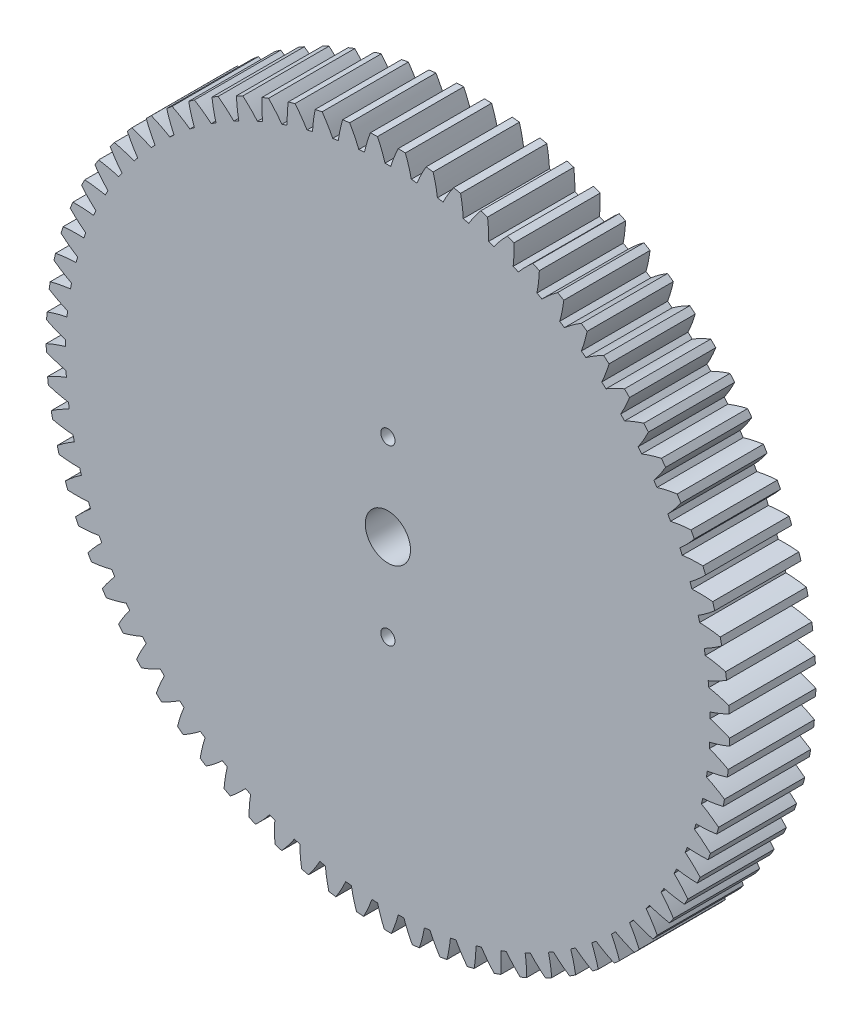
from build123d import *

# Parameters (mm, degrees)
MODEL_R             = 2.625
MODEL_R_2           = 0.825
BOSS_EXTRUDE2_DEPTH = 10


with BuildPart() as part:
    # Model → Boss-Extrude2 (new body)
    with BuildSketch(Plane.XY):
        with BuildLine():
            ThreePointArc((-39.573855354, 2.012609605), (-38.483782884, 1.509137576), (-37.358060536, 1.091416054))
            ThreePointArc((-37.358060536, 1.091416054), (-37.366223524, 0.762374936), (-37.371488451, 0.433274691))
            ThreePointArc((-37.371488451, 0.433274691), (-38.513312242, 0.06181742), (-39.623013466, -0.396773105))
            ThreePointArc((-39.623013466, -0.396773105), (-39.616755155, -0.808292044), (-39.606222982, -1.219723785))
            ThreePointArc((-39.606222982, -1.219723785), (-38.478739993, -1.632669526), (-37.322715212, -1.957244292))
            ThreePointArc((-37.322715212, -1.957244292), (-37.304031133, -2.285855912), (-37.282453816, -2.614290244))
            ThreePointArc((-37.282453816, -2.614290244), (-38.390201066, -3.077580761), (-39.458830466, -3.625096314))
            ThreePointArc((-39.458830466, -3.625096314), (-39.419050364, -4.034735848), (-39.37501773, -4.443940114))
            ThreePointArc((-39.37501773, -4.443940114), (-38.217627437, -4.763611481), (-37.038993376, -4.9928795))
            ThreePointArc((-37.038993376, -4.9928795), (-36.993586569, -5.318874766), (-36.945310601, -5.644457508))
            ThreePointArc((-36.945310601, -5.644457508), (-38.011609436, -6.196498149), (-39.032055459, -6.829295106))
            ThreePointArc((-39.032055459, -6.829295106), (-38.959018298, -7.234329151), (-38.881778232, -7.638582755))
            ThreePointArc((-38.881778232, -7.638582755), (-37.702182875, -7.862852388), (-36.50878315, -7.995287919))
            ThreePointArc((-36.50878315, -7.995287919), (-36.43695579, -8.316497386), (-36.362302441, -8.637061839))
            ThreePointArc((-36.362302441, -8.637061839), (-37.380056817, -9.274178864), (-38.345528563, -9.988046066))
            ThreePointArc((-38.345528563, -9.988046066), (-38.239720392, -10.385779186), (-38.129786915, -10.782391887))
            ThreePointArc((-38.129786915, -10.782391887), (-36.935836507, -10.90976731), (-35.735612996, -10.944489016))
            ThreePointArc((-35.735612996, -10.944489016), (-35.637843082, -11.258775088), (-35.537309157, -11.572187948))
            ThreePointArc((-35.537309157, -11.572187948), (-36.499746087, -12.290141449), (-37.403818501, -13.080328227))
            ThreePointArc((-37.403818501, -13.080328227), (-37.265943457, -13.468113575), (-37.124048157, -13.854445981))
            ThreePointArc((-37.124048157, -13.854445981), (-35.923688241, -13.88407953), (-34.724628233, -13.820856344))
            ThreePointArc((-34.724628233, -13.820856344), (-34.601566408, -14.126127499), (-34.475820943, -14.430303056))
            ThreePointArc((-34.475820943, -14.430303056), (-35.376535569, -15.22431517), (-36.213192198, -16.085562962))
            ThreePointArc((-36.213192198, -16.085562962), (-36.044167816, -16.46081989), (-35.871254983, -16.834301023))
            ThreePointArc((-35.871254983, -16.834301023), (-34.672473757, -16.765995492), (-33.482556799, -16.605248153))
            ThreePointArc((-33.482556799, -16.605248153), (-33.335022018, -16.899472863), (-33.18490183, -17.192386878))
            ThreePointArc((-33.18490183, -17.192386878), (-34.017900043, -18.057173586), (-34.781573076, -18.983750929))
            ThreePointArc((-34.781573076, -18.983750929), (-34.582524185, -19.343982165), (-34.379744526, -19.702126568))
            ThreePointArc((-34.379744526, -19.702126568), (-33.19051968, -19.53633652), (-32.017664473, -19.279134776))
            ThreePointArc((-32.017664473, -19.279134776), (-31.846638557, -19.560355023), (-31.673142669, -19.840058201))
            ThreePointArc((-31.673142669, -19.840058201), (-32.432881005, -20.769864491), (-33.118488324, -21.755605166))
            ThreePointArc((-33.118488324, -21.755605166), (-32.890739561, -22.098413429), (-32.659442541, -22.438837712))
            ThreePointArc((-32.659442541, -22.438837712), (-31.487688171, -22.176666451), (-30.339699873, -21.824721937))
            ThreePointArc((-30.339699873, -21.824721937), (-30.146320971, -22.091066247), (-29.95060397, -22.355697211))
            ThreePointArc((-29.95060397, -22.355697211), (-30.632026495, -23.344335374), (-31.235005496, -24.38267944))
            ThreePointArc((-31.235005496, -24.38267944), (-30.980072493, -24.705783399), (-30.721797355, -25.026222094))
            ThreePointArc((-30.721797355, -25.026222094), (-29.575311292, -24.669414326), (-28.459829575, -24.225069175))
            ThreePointArc((-28.459829575, -24.225069175), (-28.245384592, -24.47476507), (-28.028748944, -24.722562744))
            ThreePointArc((-28.028748944, -24.722562744), (-28.627320902, -25.763453557), (-29.143658859, -26.847491005))
            ThreePointArc((-29.143658859, -26.847491005), (-28.863238153, -27.148740455), (-28.579703676, -27.447061096))
            ThreePointArc((-28.579703676, -27.447061096), (-27.466115596, -26.997991319), (-26.390563808, -26.464202574))
            ThreePointArc((-26.390563808, -26.464202574), (-26.156479839, -26.69558837), (-25.920367217, -26.924903701))
            ThreePointArc((-25.920367217, -26.924903701), (-26.432105212, -28.011120207), (-26.858365982, -29.133636947))
            ThreePointArc((-26.858365982, -29.133636947), (-26.554323725, -29.411027124), (-26.247416784, -29.685244435))
            ThreePointArc((-26.247416784, -29.685244435), (-25.174137433, -29.146901134), (-24.145673192, -28.527221072))
            ThreePointArc((-24.145673192, -28.527221072), (-23.893508028, -28.738756934), (-23.639489723, -28.948063866))
            ThreePointArc((-23.639489723, -28.948063866), (-24.060988223, -30.072377474), (-24.39433511, -31.225903342))
            ThreePointArc((-24.39433511, -31.225903342), (-24.068694654, -31.477588259), (-23.740457664, -31.72587737))
            ThreePointArc((-23.740457664, -31.72587737), (-22.714629538, -31.101843131), (-21.740097106, -30.400395619))
            ThreePointArc((-21.740097106, -30.400395619), (-21.471528863, -30.590673812), (-21.201295325, -30.778579443))
            ThreePointArc((-21.201295325, -30.778579443), (-21.529749327, -31.93350803), (-21.767963963, -33.110366502))
            ThreePointArc((-21.767963963, -33.110366502), (-21.422892392, -33.334671238), (-21.075509715, -33.555379825))
            ThreePointArc((-21.075509715, -33.555379825), (-20.103959532, -32.849807494), (-19.189844259, -32.07126055))
            ThreePointArc((-19.189844259, -32.07126055), (-18.906660217, -32.239014802), (-18.622009805, -32.404268651))
            ThreePointArc((-18.622009805, -32.404268651), (-18.855233502, -33.582126359), (-18.996730607, -34.774485636))
            ThreePointArc((-18.996730607, -34.774485636), (-18.634524314, -34.96991748), (-18.270307727, -35.161576764))
            ThreePointArc((-18.270307727, -35.161576764), (-17.359500991, -34.379161807), (-16.511886166, -33.528696533))
            ThreePointArc((-16.511886166, -33.528696533), (-16.215970866, -33.672810469), (-15.918797882, -33.814312797))
            ThreePointArc((-15.918797882, -33.814312797), (-16.055239208, -35.007261178), (-16.099077143, -36.207186305))
            ThreePointArc((-16.099077143, -36.207186305), (-15.722146553, -36.37244469), (-15.343519855, -36.533779211))
            ThreePointArc((-15.343519855, -36.533779211), (-14.499517836, -35.679728471), (-13.724044194, -34.763004573))
            ThreePointArc((-13.724044194, -34.763004573), (-13.417366904, -34.882519137), (-13.109648986, -34.999328271))
            ThreePointArc((-13.109648986, -34.999328271), (-13.148399947, -36.19942845), (-13.094286977, -37.398934123))
            ThreePointArc((-13.094286977, -37.398934123), (-12.705140499, -37.532919283), (-12.314623389, -37.662855385))
            ThreePointArc((-12.314623389, -37.662855385), (-11.543042782, -36.742852429), (-10.844870973, -35.765970553))
            ThreePointArc((-10.844870973, -35.765970553), (-10.529472579, -35.860090396), (-10.213257538, -35.951428991))
            ThreePointArc((-10.213257538, -35.951428991), (-10.154060253, -37.150694497), (-10.002356492, -38.341798205))
            ThreePointArc((-10.002356492, -38.341798205), (-9.603583832, -38.44361849), (-9.203775137, -38.541291471))
            ThreePointArc((-9.203775137, -38.541291471), (-8.509750682, -37.561458765), (-7.893526924, -36.530919899))
            ThreePointArc((-7.893526924, -36.530919899), (-7.571506352, -36.599018669), (-7.248898547, -36.664278881))
            ThreePointArc((-7.248898547, -36.664278881), (-7.092146963, -37.854728802), (-6.843861974, -39.029503946))
            ThreePointArc((-6.843861974, -39.029503946), (-6.438116899, -39.098481758), (-6.03167728, -39.16324162))
            ThreePointArc((-6.03167728, -39.16324162), (-5.419827596, -38.130099791), (-4.889652756, -37.052762001))
            ThreePointArc((-4.889652756, -37.052762001), (-4.563152999, -37.094386512), (-4.236299331, -37.133134045))
            ThreePointArc((-4.236299331, -37.133134045), (-3.983036606, -38.306846133), (-3.639822684, -39.457474778))
            ThreePointArc((-3.639822684, -39.457474778), (-3.229805361, -39.493151081), (-2.819439605, -39.524566858))
            ThreePointArc((-2.819439605, -39.524566858), (-2.293836451, -38.444991294), (-1.853238756, -37.328024085))
            ThreePointArc((-1.853238756, -37.328024085), (-1.524432615, -37.342897333), (-1.195508243, -37.354874328))
            ThreePointArc((-1.195508243, -37.354874328), (-0.847419797, -38.504037723), (-0.411560974, -39.622862625))
            ThreePointArc((-0.411560974, -39.622862625), (0, -39.625), (0.411560974, -39.622862625))
            ThreePointArc((0.411560974, -39.622862625), (0.847419797, -38.504037723), (1.195508243, -37.354874328))
            ThreePointArc((1.195508243, -37.354874328), (1.524432615, -37.342897333), (1.853238756, -37.328024085))
            ThreePointArc((1.853238756, -37.328024085), (2.293836451, -38.444991294), (2.819439605, -39.524566858))
            ThreePointArc((2.819439605, -39.524566858), (3.229805361, -39.493151081), (3.639822684, -39.457474778))
            ThreePointArc((3.639822684, -39.457474778), (3.983036606, -38.306846133), (4.236299331, -37.133134045))
            ThreePointArc((4.236299331, -37.133134045), (4.563152999, -37.094386512), (4.889652756, -37.052762001))
            ThreePointArc((4.889652756, -37.052762001), (5.419827596, -38.130099791), (6.03167728, -39.16324162))
            ThreePointArc((6.03167728, -39.16324162), (6.438116899, -39.098481758), (6.843861974, -39.029503946))
            ThreePointArc((6.843861974, -39.029503946), (7.092146963, -37.854728802), (7.248898547, -36.664278881))
            ThreePointArc((7.248898547, -36.664278881), (7.571506352, -36.599018669), (7.893526924, -36.530919899))
            ThreePointArc((7.893526924, -36.530919899), (8.509750682, -37.561458765), (9.203775137, -38.541291471))
            ThreePointArc((9.203775137, -38.541291471), (9.603583832, -38.44361849), (10.002356491, -38.341798205))
            ThreePointArc((10.002356491, -38.341798205), (10.154060253, -37.150694497), (10.213257538, -35.951428991))
            ThreePointArc((10.213257538, -35.951428991), (10.529472579, -35.860090396), (10.844870973, -35.765970553))
            ThreePointArc((10.844870973, -35.765970553), (11.543042782, -36.742852429), (12.314623389, -37.662855385))
            ThreePointArc((12.314623389, -37.662855385), (12.705140499, -37.532919283), (13.094286977, -37.398934123))
            ThreePointArc((13.094286977, -37.398934123), (13.148399947, -36.19942845), (13.109648986, -34.999328272))
            ThreePointArc((13.109648986, -34.999328272), (13.417366904, -34.882519137), (13.724044194, -34.763004573))
            ThreePointArc((13.724044194, -34.763004573), (14.499517836, -35.679728471), (15.343519855, -36.533779211))
            ThreePointArc((15.343519855, -36.533779211), (15.722146553, -36.372444691), (16.099077143, -36.207186305))
            ThreePointArc((16.099077143, -36.207186305), (16.055239208, -35.007261178), (15.918797882, -33.814312798))
            ThreePointArc((15.918797882, -33.814312798), (16.215970866, -33.672810469), (16.511886166, -33.528696534))
            ThreePointArc((16.511886166, -33.528696534), (17.359500991, -34.379161808), (18.270307727, -35.161576764))
            ThreePointArc((18.270307727, -35.161576764), (18.634524315, -34.96991748), (18.996730607, -34.774485636))
            ThreePointArc((18.996730607, -34.774485636), (18.855233502, -33.58212636), (18.622009805, -32.404268651))
            ThreePointArc((18.622009805, -32.404268651), (18.906660217, -32.239014803), (19.18984426, -32.07126055))
            ThreePointArc((19.18984426, -32.07126055), (20.103959532, -32.849807494), (21.075509716, -33.555379825))
            ThreePointArc((21.075509716, -33.555379825), (21.422892392, -33.334671238), (21.767963963, -33.110366502))
            ThreePointArc((21.767963963, -33.110366502), (21.529749328, -31.933508031), (21.201295325, -30.778579443))
            ThreePointArc((21.201295325, -30.778579443), (21.471528863, -30.590673812), (21.740097106, -30.40039562))
            ThreePointArc((21.740097106, -30.40039562), (22.714629538, -31.101843132), (23.740457664, -31.72587737))
            ThreePointArc((23.740457664, -31.72587737), (24.068694654, -31.477588259), (24.39433511, -31.225903342))
            ThreePointArc((24.39433511, -31.225903342), (24.060988224, -30.072377474), (23.639489723, -28.948063867))
            ThreePointArc((23.639489723, -28.948063867), (23.893508028, -28.738756934), (24.145673193, -28.527221072))
            ThreePointArc((24.145673193, -28.527221072), (25.174137433, -29.146901135), (26.247416784, -29.685244435))
            ThreePointArc((26.247416784, -29.685244435), (26.554323725, -29.411027124), (26.858365982, -29.133636947))
            ThreePointArc((26.858365982, -29.133636947), (26.432105213, -28.011120208), (25.920367217, -26.924903701))
            ThreePointArc((25.920367217, -26.924903701), (26.156479839, -26.69558837), (26.390563808, -26.464202574))
            ThreePointArc((26.390563808, -26.464202574), (27.466115597, -26.99799132), (28.579703676, -27.447061096))
            ThreePointArc((28.579703676, -27.447061096), (28.863238153, -27.148740456), (29.14365886, -26.847491005))
            ThreePointArc((29.14365886, -26.847491005), (28.627320903, -25.763453557), (28.028748944, -24.722562744))
            ThreePointArc((28.028748944, -24.722562744), (28.245384592, -24.47476507), (28.459829575, -24.225069175))
            ThreePointArc((28.459829575, -24.225069175), (29.575311292, -24.669414327), (30.721797355, -25.026222094))
            ThreePointArc((30.721797355, -25.026222094), (30.980072493, -24.705783399), (31.235005496, -24.38267944))
            ThreePointArc((31.235005496, -24.38267944), (30.632026495, -23.344335374), (29.950603971, -22.355697211))
            ThreePointArc((29.950603971, -22.355697211), (30.146320971, -22.091066247), (30.339699873, -21.824721937))
            ThreePointArc((30.339699873, -21.824721937), (31.487688171, -22.176666451), (32.659442541, -22.438837712))
            ThreePointArc((32.659442541, -22.438837712), (32.890739562, -22.098413429), (33.118488324, -21.755605166))
            ThreePointArc((33.118488324, -21.755605166), (32.432881005, -20.769864491), (31.673142669, -19.840058201))
            ThreePointArc((31.673142669, -19.840058201), (31.846638557, -19.560355023), (32.017664473, -19.279134776))
            ThreePointArc((32.017664473, -19.279134776), (33.19051968, -19.53633652), (34.379744526, -19.702126568))
            ThreePointArc((34.379744526, -19.702126568), (34.582524185, -19.343982165), (34.781573076, -18.983750929))
            ThreePointArc((34.781573076, -18.983750929), (34.017900043, -18.057173586), (33.18490183, -17.192386878))
            ThreePointArc((33.18490183, -17.192386878), (33.335022018, -16.899472863), (33.482556799, -16.605248153))
            ThreePointArc((33.482556799, -16.605248153), (34.672473757, -16.765995492), (35.871254983, -16.834301023))
            ThreePointArc((35.871254983, -16.834301023), (36.044167816, -16.46081989), (36.213192198, -16.085562962))
            ThreePointArc((36.213192198, -16.085562962), (35.376535569, -15.22431517), (34.475820943, -14.430303056))
            ThreePointArc((34.475820943, -14.430303056), (34.601566408, -14.126127499), (34.724628233, -13.820856344))
            ThreePointArc((34.724628233, -13.820856344), (35.923688241, -13.88407953), (37.124048157, -13.854445981))
            ThreePointArc((37.124048157, -13.854445981), (37.265943457, -13.468113575), (37.403818501, -13.080328227))
            ThreePointArc((37.403818501, -13.080328227), (36.499746087, -12.290141449), (35.537309157, -11.572187948))
            ThreePointArc((35.537309157, -11.572187948), (35.637843082, -11.258775088), (35.735612996, -10.944489016))
            ThreePointArc((35.735612996, -10.944489016), (36.935836507, -10.90976731), (38.129786915, -10.782391887))
            ThreePointArc((38.129786915, -10.782391887), (38.239720392, -10.385779186), (38.345528563, -9.988046066))
            ThreePointArc((38.345528563, -9.988046066), (37.380056817, -9.274178864), (36.362302441, -8.637061839))
            ThreePointArc((36.362302441, -8.637061839), (36.43695579, -8.316497386), (36.50878315, -7.995287919))
            ThreePointArc((36.50878315, -7.995287919), (37.702182875, -7.862852388), (38.881778232, -7.638582755))
            ThreePointArc((38.881778232, -7.638582755), (38.959018298, -7.234329151), (39.032055459, -6.829295106))
            ThreePointArc((39.032055459, -6.829295106), (38.011609436, -6.196498149), (36.945310601, -5.644457508))
            ThreePointArc((36.945310601, -5.644457508), (36.993586569, -5.318874766), (37.038993376, -4.9928795))
            ThreePointArc((37.038993376, -4.9928795), (38.217627437, -4.763611481), (39.37501773, -4.443940114))
            ThreePointArc((39.37501773, -4.443940114), (39.419050364, -4.034735848), (39.458830466, -3.625096314))
            ThreePointArc((39.458830466, -3.625096314), (38.390201066, -3.077580761), (37.282453816, -2.614290244))
            ThreePointArc((37.282453816, -2.614290244), (37.304031133, -2.285855912), (37.322715212, -1.957244292))
            ThreePointArc((37.322715212, -1.957244292), (38.478739993, -1.632669526), (39.606222982, -1.219723785))
            ThreePointArc((39.606222982, -1.219723785), (39.616755154, -0.808292044), (39.623013466, -0.396773105))
            ThreePointArc((39.623013466, -0.396773105), (38.513312242, 0.06181742), (37.371488451, 0.433274691))
            ThreePointArc((37.371488451, 0.433274691), (37.366223524, 0.762374936), (37.358060536, 1.091416054))
            ThreePointArc((37.358060536, 1.091416054), (38.483782884, 1.509137576), (39.573855354, 2.012609605))
            ThreePointArc((39.573855354, 2.012609605), (39.550816975, 2.42353081), (39.523511848, 2.834190565))
            ThreePointArc((39.523511848, 2.834190565), (38.380123679, 3.200804215), (37.211821996, 3.477956254))
            ThreePointArc((37.211821996, 3.477956254), (37.179749863, 3.805532305), (37.144794131, 4.132813206))
            ThreePointArc((37.144794131, 4.132813206), (38.232722548, 4.640901616), (39.278130248, 5.231549409))
            ThreePointArc((39.278130248, 5.231549409), (39.221674635, 5.639225467), (39.160987781, 6.046293163))
            ThreePointArc((39.160987781, 6.046293163), (37.991521725, 6.318490187), (36.804517006, 6.499492592))
            ThreePointArc((36.804517006, 6.499492592), (36.745851101, 6.823364484), (36.684335249, 7.146707168))
            ThreePointArc((36.684335249, 7.146707168), (37.727229752, 7.741781222), (38.721015666, 8.415674116))
            ThreePointArc((38.721015666, 8.415674116), (38.63151852, 8.817392008), (38.537853801, 9.218158679))
            ThreePointArc((38.537853801, 9.218158679), (37.350092463, 9.394127649), (36.152284027, 9.477775879))
            ThreePointArc((36.152284027, 9.477775879), (36.067414762, 9.795788298), (35.979748169, 10.113040973))
            ThreePointArc((35.979748169, 10.113040973), (36.970668467, 10.791140551), (37.906219112, 11.543793899))
            ThreePointArc((37.906219112, 11.543793899), (37.784276024, 11.93688026), (37.658256762, 12.328678869))
            ThreePointArc((37.658256762, 12.328678869), (36.460104497, 12.407248741), (35.259463563, 12.392986131))
            ThreePointArc((35.259463563, 12.392986131), (35.148955729, 12.703022757), (35.035721801, 13.012074159))
            ThreePointArc((35.035721801, 13.012074159), (35.968073482, 13.76868662), (36.839162925, 14.595091639))
            ThreePointArc((36.839162925, 14.595091639), (36.685585405, 14.976930544), (36.528050237, 15.357153735))
            ThreePointArc((36.528050237, 15.357153735), (35.327480552, 15.33780164), (34.131997186, 15.225723105))
            ThreePointArc((34.131997186, 15.225723105), (33.996586194, 15.525720696), (33.858538484, 15.824514138))
            ThreePointArc((33.858538484, 15.824514138), (34.726116903, 16.654604351), (35.526948187, 17.549261453))
            ThreePointArc((35.526948187, 17.549261453), (35.342758267, 17.917311826), (35.154755565, 18.283429277))
            ThreePointArc((35.154755565, 18.283429277), (33.959758051, 18.166283999), (32.777388, 17.957135404))
            ThreePointArc((32.777388, 17.957135404), (32.617974988, 18.245097525), (32.456032181, 18.531644586))
            ThreePointArc((32.456032181, 18.531644586), (33.253063745, 19.429688438), (33.97830747, 20.386643826))
            ThreePointArc((33.97830747, 20.386643826), (33.764730904, 20.738456354), (33.547511795, 21.088031614))
            ThreePointArc((33.547511795, 21.088031614), (32.366038964, 20.873872736), (31.204650704, 20.56904593))
            ThreePointArc((31.204650704, 20.56904593), (31.022296539, 20.84305624), (30.837536338, 21.115449998))
            ThreePointArc((30.837536338, 21.115449998), (31.558716935, 22.075471154), (32.203546722, 23.088356448))
            ThreePointArc((32.203546722, 23.088356448), (31.962004829, 23.421589876), (31.717014869, 23.75229658))
            ThreePointArc((31.717014869, 23.75229658), (30.556929228, 23.442549294), (29.424251606, 23.044072849))
            ThreePointArc((29.424251606, 23.044072849), (29.220169826, 23.302307855), (29.013821779, 23.558735573))
            ThreePointArc((29.013821779, 23.558735573), (29.65435207, 24.574345252), (30.214476685, 25.636419868))
            ThreePointArc((30.214476685, 25.636419868), (29.946576884, 25.948856583), (29.675446441, 26.258493931))
            ThreePointArc((29.675446441, 26.258493931), (28.54446817, 25.855219554), (27.448038968, 25.365745264))
            ThreePointArc((27.448038968, 25.365745264), (27.223587703, 25.606486455), (26.997025022, 25.84524165))
            ThreePointArc((26.997025022, 25.84524165), (27.552642385, 26.909681137), (28.02433429, 28.013877143))
            ThreePointArc((28.02433429, 28.013877143), (27.731859411, 28.303437929), (27.436392814, 28.589945337))
            ThreePointArc((27.436392814, 28.589945337), (26.342048385, 28.095827593), (25.289164159, 27.518612831))
            ThreePointArc((25.289164159, 27.518612831), (25.045837095, 27.740258113), (24.800567519, 27.959751908))
            ThreePointArc((24.800567519, 27.959751908), (25.26757441, 29.065937533), (25.647694574, 30.204906688))
            ThreePointArc((25.647694574, 30.204906688), (25.332590989, 30.469664567), (25.014754519, 30.731135373))
            ThreePointArc((25.014754519, 30.731135373), (23.964326614, 30.149462536), (22.961994136, 29.488348569))
            ThreePointArc((22.961994136, 29.488348569), (22.701410574, 29.68942293), (22.43906633, 29.88819463))
            ThreePointArc((22.43906633, 29.88819463), (22.814354897, 31.028764911), (23.100373683, 32.194927562))
            ThreePointArc((23.100373683, 32.194927562), (22.764738353, 32.433120613), (22.42664716, 32.667814774))
            ThreePointArc((22.42664716, 32.667814774), (21.427126203, 32.002457779), (20.48201583, 31.261844212))
            ThreePointArc((20.48201583, 31.261844212), (20.205909912, 31.441009536), (19.928236857, 31.617736348))
            ThreePointArc((19.928236857, 31.617736348), (20.209309616, 32.785100978), (20.399323615, 33.970696505))
            ThreePointArc((20.399323615, 33.970696505), (20.04539014, 34.180739593), (19.689294165, 34.387095258))
            ThreePointArc((19.689294165, 34.387095258), (18.747331803, 33.642481946), (17.865733087, 32.82729744))
            ThreePointArc((17.865733087, 32.82729744), (17.575942252, 32.983361411), (17.284788256, 33.136867247))
            ThreePointArc((17.284788256, 33.136867247), (17.469774713, 34.323257607), (17.562519415, 35.520396067))
            ThreePointArc((17.562519415, 35.520396067), (17.192643162, 35.700891391), (16.820912165, 35.877535296))
            ThreePointArc((16.820912165, 35.877535296), (15.942777003, 35.058620947), (15.130556839, 34.17429042))
            ThreePointArc((15.130556839, 34.17429042), (14.829009596, 34.306214457), (14.52631224, 34.435477762))
            ThreePointArc((14.52631224, 34.435477762), (14.613981343, 35.632998619), (14.608839546, 36.833713255))
            ThreePointArc((14.608839546, 36.833713255), (14.225481981, 36.983459646), (13.84058977, 37.129216256))
            ThreePointArc((13.84058977, 37.129216256), (13.032125652, 36.241450609), (12.294689232, 35.293859136))
            ThreePointArc((12.294689232, 35.293859136), (11.983392329, 35.400765307), (11.671166014, 35.504925854))
            ThreePointArc((11.671166014, 35.504925854), (11.660934337, 36.705607905), (11.55794026, 37.901908157))
            ThreePointArc((11.55794026, 37.901908157), (11.163652565, 38.019909079), (10.768160533, 38.133808408))
            ThreePointArc((10.768160533, 38.133808408), (10.034747655, 37.183099397), (9.377002496, 36.178553042))
            ThreePointArc((9.377002496, 36.178553042), (9.058027562, 36.259729904), (8.738350103, 36.338094522))
            ThreePointArc((8.738350103, 36.338094522), (8.630285738, 37.533947426), (8.430124788, 38.717872114))
            ThreePointArc((8.430124788, 38.717872114), (8.027530882, 38.803342291), (7.624070965, 38.884626357))
            ThreePointArc((7.624070965, 38.884626357), (6.970590069, 37.877300793), (6.396913355, 36.822484646))
            ThreePointArc((6.396913355, 36.822484646), (6.072383117, 36.877391981), (5.747381914, 36.929439166))
            ThreePointArc((5.747381914, 36.929439166), (5.54220401, 38.112504719), (5.246208227, 39.276175021))
            ThreePointArc((5.246208227, 39.276175021), (4.837987306, 39.328545661), (4.429244463, 39.376673533))
            ThreePointArc((4.429244463, 39.376673533), (3.860044355, 38.319435002), (3.374253812, 37.221368691))
            ThreePointArc((3.374253812, 37.221368691), (3.046327963, 37.249641098), (2.718165847, 37.275024486))
            ThreePointArc((2.718165847, 37.275024486), (2.41723983, 38.437429582), (2.027379015, 39.573101462))
            ThreePointArc((2.027379015, 39.573101462), (1.616247723, 39.592024049), (1.204942069, 39.606675443))
            ThreePointArc((1.204942069, 39.606675443), (0.723810683, 38.506559692), (0.329139166, 37.372550668))
            ThreePointArc((0.329139166, 37.372550668), (0, 37.374), (-0.329139166, 37.372550668))
            ThreePointArc((-0.329139166, 37.372550668), (-0.723810683, 38.506559693), (-1.204942069, 39.606675443))
            ThreePointArc((-1.204942069, 39.606675443), (-1.616247723, 39.592024049), (-2.027379015, 39.573101462))
            ThreePointArc((-2.027379015, 39.573101462), (-2.41723983, 38.437429582), (-2.718165847, 37.275024486))
            ThreePointArc((-2.718165847, 37.275024486), (-3.046327963, 37.249641098), (-3.374253812, 37.221368691))
            ThreePointArc((-3.374253812, 37.221368691), (-3.860044355, 38.319435002), (-4.429244463, 39.376673533))
            ThreePointArc((-4.429244463, 39.376673533), (-4.837987306, 39.328545661), (-5.246208227, 39.276175021))
            ThreePointArc((-5.246208227, 39.276175021), (-5.54220401, 38.112504719), (-5.747381914, 36.929439166))
            ThreePointArc((-5.747381914, 36.929439166), (-6.072383117, 36.877391981), (-6.396913355, 36.822484646))
            ThreePointArc((-6.396913355, 36.822484646), (-6.970590069, 37.877300793), (-7.624070965, 38.884626357))
            ThreePointArc((-7.624070965, 38.884626357), (-8.027530882, 38.803342291), (-8.430124788, 38.717872114))
            ThreePointArc((-8.430124788, 38.717872114), (-8.630285738, 37.533947426), (-8.738350103, 36.338094522))
            ThreePointArc((-8.738350103, 36.338094522), (-9.058027562, 36.259729904), (-9.377002496, 36.178553042))
            ThreePointArc((-9.377002496, 36.178553042), (-10.034747655, 37.183099397), (-10.768160533, 38.133808408))
            ThreePointArc((-10.768160533, 38.133808408), (-11.163652565, 38.019909079), (-11.55794026, 37.901908157))
            ThreePointArc((-11.55794026, 37.901908157), (-11.660934337, 36.705607905), (-11.671166014, 35.504925854))
            ThreePointArc((-11.671166014, 35.504925854), (-11.983392329, 35.400765307), (-12.294689232, 35.293859136))
            ThreePointArc((-12.294689232, 35.293859136), (-13.032125652, 36.241450609), (-13.84058977, 37.129216256))
            ThreePointArc((-13.84058977, 37.129216256), (-14.225481981, 36.983459646), (-14.608839546, 36.833713255))
            ThreePointArc((-14.608839546, 36.833713255), (-14.613981343, 35.632998619), (-14.526312241, 34.435477762))
            ThreePointArc((-14.526312241, 34.435477762), (-14.829009596, 34.306214457), (-15.130556839, 34.17429042))
            ThreePointArc((-15.130556839, 34.17429042), (-15.942777003, 35.058620947), (-16.820912165, 35.877535296))
            ThreePointArc((-16.820912165, 35.877535296), (-17.192643163, 35.700891391), (-17.562519415, 35.520396068))
            ThreePointArc((-17.562519415, 35.520396068), (-17.469774713, 34.323257607), (-17.284788256, 33.136867247))
            ThreePointArc((-17.284788256, 33.136867247), (-17.575942252, 32.983361411), (-17.865733088, 32.82729744))
            ThreePointArc((-17.865733088, 32.82729744), (-18.747331803, 33.642481946), (-19.689294165, 34.387095258))
            ThreePointArc((-19.689294165, 34.387095258), (-20.04539014, 34.180739593), (-20.399323615, 33.970696505))
            ThreePointArc((-20.399323615, 33.970696505), (-20.209309616, 32.785100978), (-19.928236857, 31.617736348))
            ThreePointArc((-19.928236857, 31.617736348), (-20.205909912, 31.441009536), (-20.48201583, 31.261844212))
            ThreePointArc((-20.48201583, 31.261844212), (-21.427126204, 32.002457779), (-22.42664716, 32.667814775))
            ThreePointArc((-22.42664716, 32.667814775), (-22.764738353, 32.433120613), (-23.100373683, 32.194927562))
            ThreePointArc((-23.100373683, 32.194927562), (-22.814354897, 31.028764911), (-22.43906633, 29.88819463))
            ThreePointArc((-22.43906633, 29.88819463), (-22.701410575, 29.68942293), (-22.961994136, 29.488348569))
            ThreePointArc((-22.961994136, 29.488348569), (-23.964326614, 30.149462536), (-25.014754519, 30.731135373))
            ThreePointArc((-25.014754519, 30.731135373), (-25.332590989, 30.469664567), (-25.647694574, 30.204906688))
            ThreePointArc((-25.647694574, 30.204906688), (-25.26757441, 29.065937533), (-24.800567519, 27.959751908))
            ThreePointArc((-24.800567519, 27.959751908), (-25.045837096, 27.740258113), (-25.289164159, 27.518612831))
            ThreePointArc((-25.289164159, 27.518612831), (-26.342048385, 28.095827593), (-27.436392814, 28.589945337))
            ThreePointArc((-27.436392814, 28.589945337), (-27.731859411, 28.303437929), (-28.02433429, 28.013877143))
            ThreePointArc((-28.02433429, 28.013877143), (-27.552642385, 26.909681137), (-26.997025022, 25.84524165))
            ThreePointArc((-26.997025022, 25.84524165), (-27.223587703, 25.606486455), (-27.448038968, 25.365745264))
            ThreePointArc((-27.448038968, 25.365745264), (-28.54446817, 25.855219554), (-29.675446442, 26.258493931))
            ThreePointArc((-29.675446442, 26.258493931), (-29.946576884, 25.948856583), (-30.214476685, 25.636419868))
            ThreePointArc((-30.214476685, 25.636419868), (-29.65435207, 24.574345252), (-29.013821779, 23.558735573))
            ThreePointArc((-29.013821779, 23.558735573), (-29.220169826, 23.302307855), (-29.424251606, 23.044072849))
            ThreePointArc((-29.424251606, 23.044072849), (-30.556929228, 23.442549294), (-31.717014869, 23.75229658))
            ThreePointArc((-31.717014869, 23.75229658), (-31.962004829, 23.421589876), (-32.203546723, 23.088356449))
            ThreePointArc((-32.203546723, 23.088356449), (-31.558716935, 22.075471154), (-30.837536338, 21.115449998))
            ThreePointArc((-30.837536338, 21.115449998), (-31.022296539, 20.84305624), (-31.204650704, 20.56904593))
            ThreePointArc((-31.204650704, 20.56904593), (-32.366038965, 20.873872736), (-33.547511795, 21.088031614))
            ThreePointArc((-33.547511795, 21.088031614), (-33.764730905, 20.738456354), (-33.97830747, 20.386643826))
            ThreePointArc((-33.97830747, 20.386643826), (-33.253063745, 19.429688438), (-32.456032181, 18.531644586))
            ThreePointArc((-32.456032181, 18.531644586), (-32.617974988, 18.245097525), (-32.777388, 17.957135404))
            ThreePointArc((-32.777388, 17.957135404), (-33.959758051, 18.166283999), (-35.154755565, 18.283429277))
            ThreePointArc((-35.154755565, 18.283429277), (-35.342758267, 17.917311826), (-35.526948187, 17.549261453))
            ThreePointArc((-35.526948187, 17.549261453), (-34.726116903, 16.654604351), (-33.858538484, 15.824514138))
            ThreePointArc((-33.858538484, 15.824514138), (-33.996586194, 15.525720696), (-34.131997186, 15.225723105))
            ThreePointArc((-34.131997186, 15.225723105), (-35.327480552, 15.33780164), (-36.528050237, 15.357153735))
            ThreePointArc((-36.528050237, 15.357153735), (-36.685585405, 14.976930544), (-36.839162925, 14.595091639))
            ThreePointArc((-36.839162925, 14.595091639), (-35.968073482, 13.76868662), (-35.035721801, 13.012074159))
            ThreePointArc((-35.035721801, 13.012074159), (-35.148955729, 12.703022757), (-35.259463563, 12.392986131))
            ThreePointArc((-35.259463563, 12.392986131), (-36.460104497, 12.407248741), (-37.658256762, 12.328678869))
            ThreePointArc((-37.658256762, 12.328678869), (-37.784276024, 11.93688026), (-37.906219113, 11.543793899))
            ThreePointArc((-37.906219113, 11.543793899), (-36.970668467, 10.791140551), (-35.979748169, 10.113040973))
            ThreePointArc((-35.979748169, 10.113040973), (-36.067414762, 9.795788298), (-36.152284027, 9.477775879))
            ThreePointArc((-36.152284027, 9.477775879), (-37.350092463, 9.394127648), (-38.537853801, 9.218158679))
            ThreePointArc((-38.537853801, 9.218158679), (-38.63151852, 8.817392008), (-38.721015666, 8.415674116))
            ThreePointArc((-38.721015666, 8.415674116), (-37.727229752, 7.741781222), (-36.684335249, 7.146707168))
            ThreePointArc((-36.684335249, 7.146707168), (-36.745851101, 6.823364484), (-36.804517006, 6.499492592))
            ThreePointArc((-36.804517006, 6.499492592), (-37.991521725, 6.318490187), (-39.160987781, 6.046293163))
            ThreePointArc((-39.160987781, 6.046293163), (-39.221674635, 5.639225467), (-39.278130248, 5.231549409))
            ThreePointArc((-39.278130248, 5.231549409), (-38.232722548, 4.640901616), (-37.144794131, 4.132813206))
            ThreePointArc((-37.144794131, 4.132813206), (-37.179749863, 3.805532305), (-37.211821996, 3.477956254))
            ThreePointArc((-37.211821996, 3.477956254), (-38.380123679, 3.200804215), (-39.523511849, 2.834190565))
            ThreePointArc((-39.523511849, 2.834190565), (-39.550816975, 2.42353081), (-39.573855354, 2.012609605))
        make_face()
        Circle(MODEL_R, mode=Mode.SUBTRACT)
        with Locations((0, 10.05)):
            Circle(MODEL_R_2, mode=Mode.SUBTRACT)
        with Locations((0, -10.05)):
            Circle(MODEL_R_2, mode=Mode.SUBTRACT)
    extrude(amount=BOSS_EXTRUDE2_DEPTH)


solid = part.part
